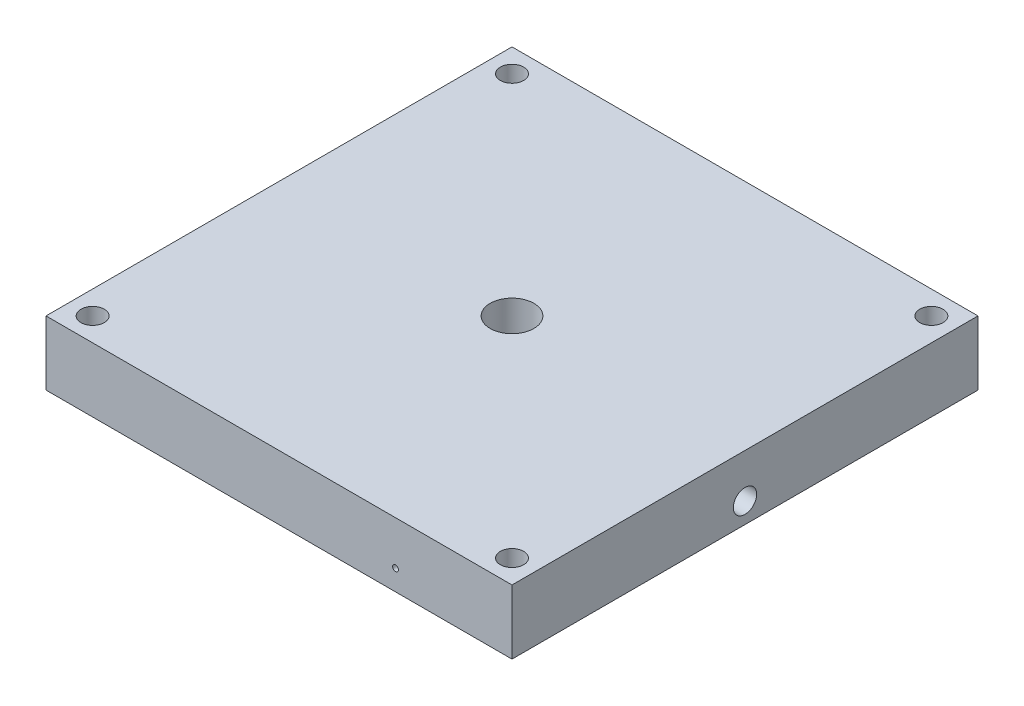
from build123d import *

# Parameters (mm, degrees)
SKETCH5_W               = 127
SKETCH5_H               = 127
SKETCH5_R               = 38.1
SKETCH5_R_2             = 3.175
BOSS_EXTRUDE2_DEPTH     = 17.50822
SKETCH4_R               = 1.03251
CUT_EXTRUDE3_DEPTH      = 3.175
CIRPATTERN1_COUNT       = 9
CUT_EXTRUDE5_REACH      = 145.066
SKETCH8_R               = 3.175
CUT_EXTRUDE9_REACH      = 165.579
CUT_EXTRUDE9_END_RADIUS = 3.175
SKETCH10_R              = 0.79375


with BuildPart() as part:
    # Sketch1 → Revolve1 (revolve)
    with BuildSketch(Plane.XY, mode=Mode.PRIVATE) as revolve1_sk:
        with BuildLine():
            Line((-32.14624, 17.50822), (0, 17.50822))
            Line((0, 17.50822), (0, 0))
            Line((0, 0), (-27.1145, 0))
            Line((-27.1145, 0), (-27.1145, 3.456354569))
            ThreePointArc((-27.1145, 3.456354569), (-27.522854569, 4.980354569), (-28.6385, 6.096))
            Line((-28.6385, 6.096), (-32.14624, 8.96874))
            Line((-32.14624, 8.96874), (-32.14624, 17.50822))
        make_face()
    revolve(revolve1_sk.sketch.rotate(Axis((-38.1, 101.60464546, 0), (0, 1, 0)), 90), axis=Axis((-38.1, 101.60464546, 0), (0, 1, 0)))

    # Sketch5 → Boss-Extrude2 (add)
    with BuildSketch(Plane.XZ):
        with Locations((-38.1, 0)):
            Rectangle(SKETCH5_W, SKETCH5_H)
        with Locations((-38.1, 0)):
            Circle(SKETCH5_R, mode=Mode.SUBTRACT)
        with Locations(Location((-95.25, 57.15, 0), (0, 0, 270))):
            Circle(SKETCH5_R_2, mode=Mode.SUBTRACT)
        with Locations(Location((19.05, 57.15, 0), (0, 0, 90))):
            Circle(SKETCH5_R_2, mode=Mode.SUBTRACT)
        with Locations(Location((19.05, -57.15, 0), (0, 0, 270))):
            Circle(SKETCH5_R_2, mode=Mode.SUBTRACT)
        with Locations(Location((-95.25, -57.15, 0), (0, 0, 90))):
            Circle(SKETCH5_R_2, mode=Mode.SUBTRACT)
    extrude(amount=-BOSS_EXTRUDE2_DEPTH)

    # Sketch4 → Cut-Extrude3 (cut)
    with BuildSketch(Plane(origin=(0, 0, 0), x_dir=(-1, 0, 0), z_dir=(0, -1, 0))):
        with Locations(Location((82.55, 0, 0), (0, 0, 90))):
            Circle(SKETCH4_R)
    cut_extrude3 = extrude(amount=-CUT_EXTRUDE3_DEPTH, mode=Mode.SUBTRACT)

    # CirPattern1: Cut-Extrude3 ×9 about axis
    cirpattern1_axis = Axis((-38.1, 0, 0), (0, 1, 0))
    for i in range(1, CIRPATTERN1_COUNT):
        add(cut_extrude3.rotate(cirpattern1_axis, i * 360 / CIRPATTERN1_COUNT), mode=Mode.SUBTRACT)

    # Sketch8 → Cut-Extrude5 (cut, up to next)
    with BuildSketch(Plane(origin=(25.4, 0, 0), x_dir=(0, 0, -1), z_dir=(1, 0, 0)), mode=Mode.PRIVATE) as cut_extrude5_sk1:
        with Locations((0, 5.588)):
            Circle(SKETCH8_R)
    cut_extrude5_tool1 = extrude(cut_extrude5_sk1.sketch, amount=-CUT_EXTRUDE5_REACH, mode=Mode.PRIVATE) & part.part
    add(cut_extrude5_tool1.solids().sort_by_distance((25.4, 5.588, 0))[0], mode=Mode.SUBTRACT)

    # Cut-Extrude9: up to this cylinder (the profile starts outside it)
    cut_extrude9_end = Plane(origin=(-6.35, 5.588, 0), z_dir=(1, 0, 0)) * Cylinder(CUT_EXTRUDE9_END_RADIUS, 338.508, mode=Mode.PRIVATE)
    # Sketch10 → Cut-Extrude9 (cut, up to the surface)
    with BuildSketch(Plane.XY.offset(63.5), mode=Mode.PRIVATE) as cut_extrude9_sk1:
        with Locations((-6.35, 5.588)):
            Circle(SKETCH10_R)
    cut_extrude9_tool1 = extrude(cut_extrude9_sk1.sketch, amount=-CUT_EXTRUDE9_REACH, mode=Mode.PRIVATE) - cut_extrude9_end
    add(cut_extrude9_tool1.solids().sort_by_distance((-6.35, 5.588, 63.5))[0], mode=Mode.SUBTRACT)


solid = part.part
